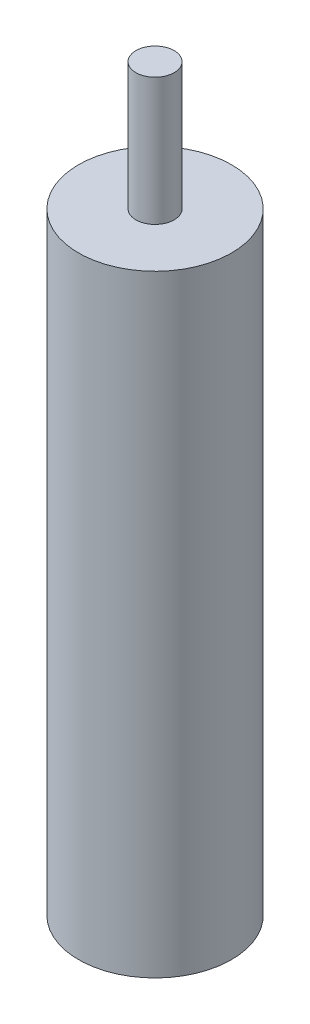
from build123d import *

# Parameters (mm, degrees)
SKETCH1_R           = 0.5
BOSS_EXTRUDE1_DEPTH = 3.333333
SKETCH2_R           = 2
BOSS_EXTRUDE2_DEPTH = 16
SCALE1_SCALE        = 2.5


with BuildPart() as part:
    # Sketch1 → Boss-Extrude1 (new body)
    with BuildSketch(Plane(origin=(0, 0, 0), x_dir=(1, 0, 0), z_dir=(0, 1, 0))):
        with Locations(Location((0, 0, 0), (0, 0, 270))):
            Circle(SKETCH1_R)
    extrude(amount=-BOSS_EXTRUDE1_DEPTH)

    # Sketch2 → Boss-Extrude2 (add)
    with BuildSketch(Plane.XZ.offset(3.333333)):
        with Locations(Location((0, 0, 0), (0, 0, 270))):
            Circle(SKETCH2_R)
    extrude(amount=BOSS_EXTRUDE2_DEPTH)


with BuildPart() as part_1:
    # Scale1: scaled about (0, -11.2090828, 0)
    add(part.part.scale(SCALE1_SCALE).moved(Location((0, 16.8136242, 0))))


solid = part_1.part
